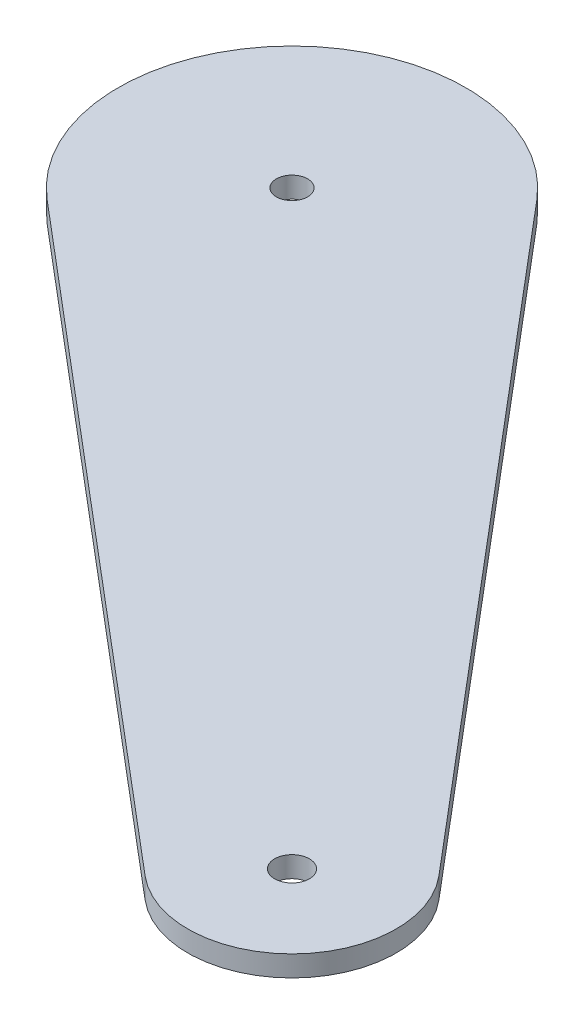
from build123d import *

# Parameters (mm, degrees)
EXTRUDE_2_DEPTH     = 3
SKETCH_4_R          = 2.25
SKETCH_4_R_2        = 2.5
CUT_EXTRUDE_2_DEPTH = 96.402519291


with BuildPart() as part:
    # 草图2 → 凸台-拉伸2 (new body)
    with BuildSketch(Plane(origin=(0, 0, 0), x_dir=(1, 0, 0), z_dir=(0, 1, 0))):
        with BuildLine():
            Line((-58.569449541, 23.337085947), (32.740581269, -53.879999426))
            ThreePointArc((32.740581269, -53.879999426), (53.033008589, -53.033008589), (53.879999426, -32.740581269))
            Line((53.879999426, -32.740581269), (-23.337085947, 58.569449541))
            ThreePointArc((-23.337085947, 58.569449541), (-60.104076401, 60.104076401), (-58.569449541, 23.337085947))
        make_face()
    extrude(amount=EXTRUDE_2_DEPTH)

    # 草图4 → 切除-拉伸2 (cut, through all)
    with BuildSketch(Plane(origin=(0, 3, 0), x_dir=(1, 0, 0), z_dir=(0, 1, 0))):
        with Locations(Location((-42.426406871, 42.426406871, 0), (0, 0, 270))):
            Circle(SKETCH_4_R)
        with Locations(Location((42.426406871, -42.426406871, 0), (0, 0, 270))):
            Circle(SKETCH_4_R_2)
    extrude(amount=-CUT_EXTRUDE_2_DEPTH, mode=Mode.SUBTRACT)


solid = part.part
